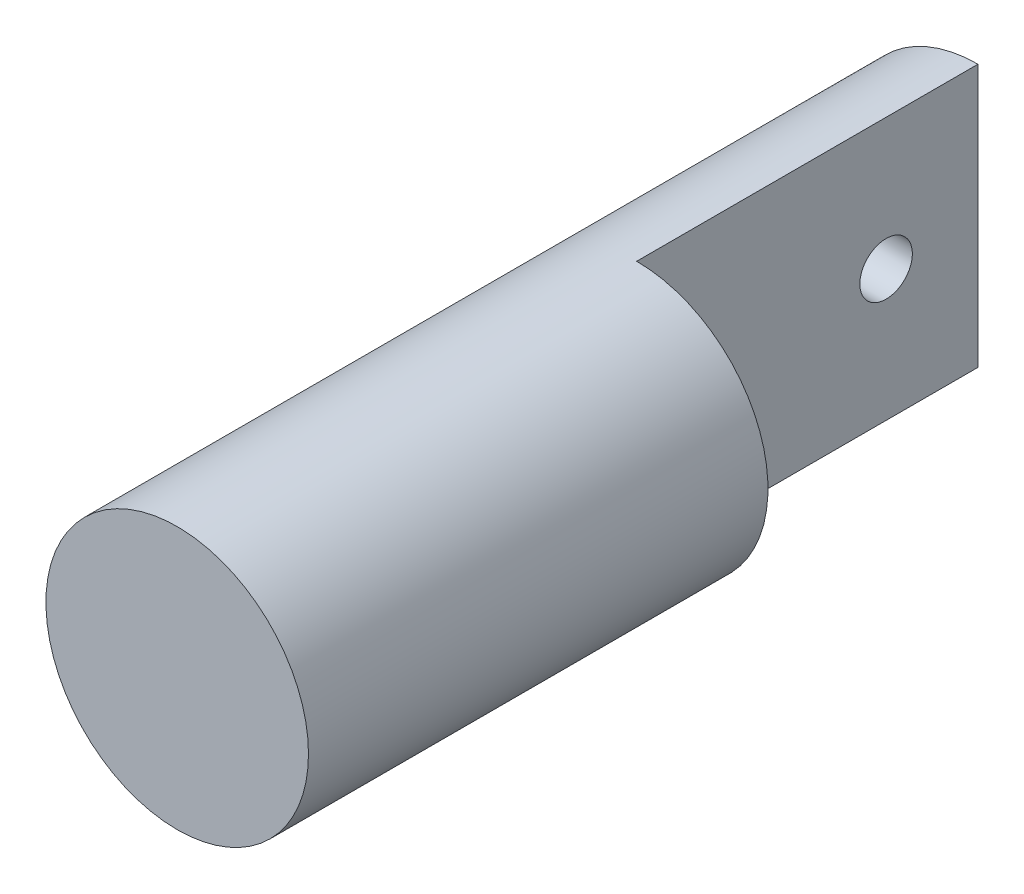
from build123d import *

# Parameters (mm, degrees)
SKETCH_1_R          = 10
EXTRUDE_1_DEPTH     = 27
SKETCH_3_W          = 10
SKETCH_3_H          = 20
CUT_EXTRUDE_2_DEPTH = 26
SKETCH_5_R          = 10
EXTRUDE_2_DEPTH     = 34
SKETCH_4_R          = 2
CUT_EXTRUDE_3_DEPTH = 63.617888818
M3X0_5_1_REACH      = 64.618
M3X0_5_1_BORE_R     = 1.25


with BuildPart() as part:
    # ｽｹｯﾁ1 → ﾎﾞｽ - 押し出し1 (new body)
    with BuildSketch(Plane.XY):
        Circle(SKETCH_1_R)
    extrude(amount=EXTRUDE_1_DEPTH)

    # ｽｹｯﾁ3 → ｶｯﾄ - 押し出し2 (cut)
    with BuildSketch(Plane(origin=(0, 0, 0), x_dir=(-1, 0, 0), z_dir=(0, 0, -1))):
        with Locations((-5, 0)):
            Rectangle(SKETCH_3_W, SKETCH_3_H)
    extrude(amount=-CUT_EXTRUDE_2_DEPTH, mode=Mode.SUBTRACT)

    # ｽｹｯﾁ5 → ﾎﾞｽ - 押し出し2 (add)
    with BuildSketch(Plane.XY.offset(27)):
        with Locations(Location((0, 0, 0), (0, 0, 270))):
            Circle(SKETCH_5_R)
    extrude(amount=EXTRUDE_2_DEPTH)

    # ｽｹｯﾁ4 → ｶｯﾄ - 押し出し3 (cut, through all)
    with BuildSketch(Plane(origin=(0, 0, 0), x_dir=(0, 0, -1), z_dir=(1, 0, 0))):
        with Locations((-7, 0)):
            Circle(SKETCH_4_R)
    extrude(amount=-CUT_EXTRUDE_3_DEPTH, mode=Mode.SUBTRACT)

    # M3x0.5 ねじ穴1 bore → M3x0.5 ねじ穴1 (cut, up to next)
    with BuildSketch(Plane(origin=(0, 0, 0), x_dir=(-1, 0, 0), z_dir=(0, 0, -1)), mode=Mode.PRIVATE) as m3x0_5_1_sk1:
        with Locations((5, 0)):
            Circle(M3X0_5_1_BORE_R)
    m3x0_5_1_tool1 = extrude(m3x0_5_1_sk1.sketch, amount=-M3X0_5_1_REACH, mode=Mode.PRIVATE) & part.part
    add(m3x0_5_1_tool1.solids().sort_by_distance((-5, 0, 0))[0], mode=Mode.SUBTRACT)


solid = part.part
